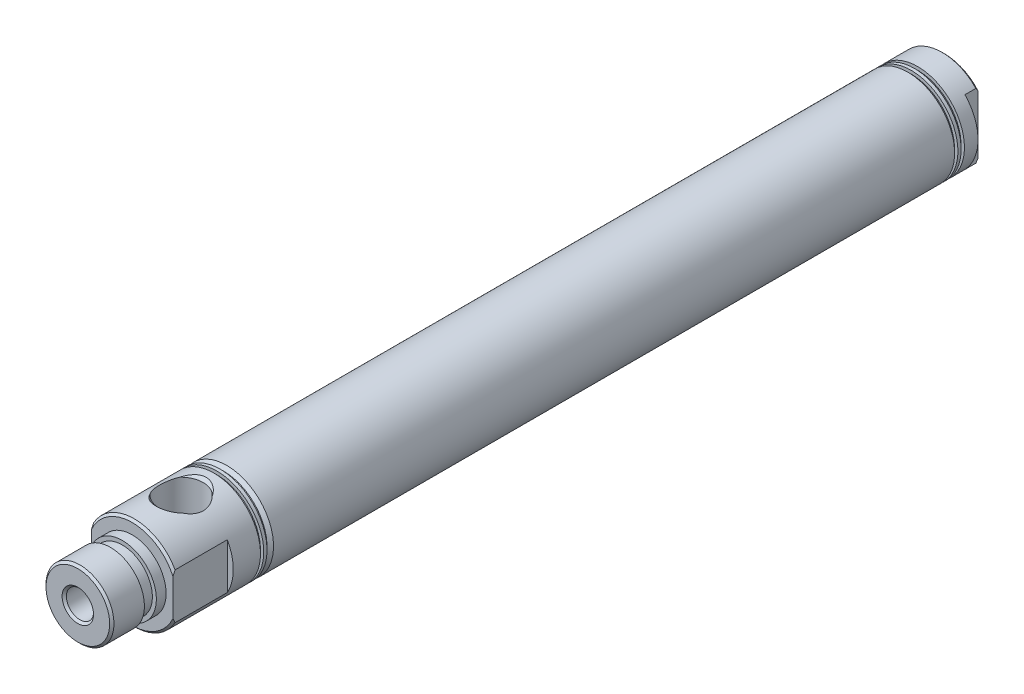
from build123d import *

# Parameters (mm, degrees)
EXTRUDE1_DEPTH      = 94.869
EXTRUDE1_DEPTH_BACK = 94.869
SKETCH1_R           = 10.922
SKETCH3_W           = 0.762
SKETCH3_H           = 0.762
RODHOLE_START       = -173.569
SKETCH8_R           = 3.175
RODHOLE_DEPTH       = 173.569
SKETCH9_R           = 9.525
STROKECHAMBER_DEPTH = 132
CHAMFER1_SIZE       = 0.5
FLATS_DEPTH         = 109.672305273
FLATS_DEPTH_BACK    = 109.672305273
SKETCH4_W           = 1.397
SKETCH4_H           = 12.7
SKETCH4_W_2         = 3.048
SKETCH4_H_2         = 3.048


with BuildPart() as part:
    # Sketch1 → Extrude1 (new, two sides: drawn at the far end of the back side and taken through both)
    with BuildSketch(Plane.XY.offset(-EXTRUDE1_DEPTH_BACK)):
        Circle(SKETCH1_R)
    extrude(amount=EXTRUDE1_DEPTH + EXTRUDE1_DEPTH_BACK)

    # Sketch2 → Nose (revolve)
    with BuildSketch(Plane(origin=(0, 0, 0), x_dir=(0, 0, -1), z_dir=(1, 0, 0)), mode=Mode.PRIVATE) as nose_sk:
        Polygon((-94.869, 7.9248), (-97.155, 7.9248), (-97.155, 7), (-99.955, 7), (-99.955, 7.9375), (-107.569, 7.9375), (-107.569, 0), (-94.869, 0), align=None)
    revolve(nose_sk.sketch.rotate(Axis((0, 0, 0), (0, 0, 1)), 90), axis=Axis((0, 0, 0), (0, 0, 1)))

    # Sketch3 → CoverGrooves (revolve, cut)
    with BuildSketch(Plane(origin=(0, 0, 0), x_dir=(0, 0, -1), z_dir=(1, 0, 0)), mode=Mode.PRIVATE) as covergrooves_sk:
        with Locations((-75.438, 10.541)):
            Rectangle(SKETCH3_W, SKETCH3_H)
        Polygon((-74.295, 10.922), (-74.295, 10.16), (-73.533, 10.16), (-72.771, 10.922), align=None)
        Polygon((88.646, 10.922), (88.646, 10.16), (87.884, 10.922), align=None)
        Polygon((87.122, 10.922), (87.122, 10.16), (86.36, 10.922), align=None)
    revolve(covergrooves_sk.sketch.rotate(Axis((0, 0, 0), (0, 0, 1)), 90), axis=Axis((0, 0, 0), (0, 0, 1)), mode=Mode.SUBTRACT)

    # Sketch7 → FrontPort (revolve, cut)
    with BuildSketch(Plane(origin=(0, 0, 0), x_dir=(0, 0, -1), z_dir=(1, 0, 0))):
        Polygon((-83.439, 10.922), (-77.589, 10.922), (-78.289, 10.222), (-78.289, 0), (-83.439, 0), align=None)
    revolve(axis=Axis((0, 0, 83.439), (0, 1, 0)), mode=Mode.SUBTRACT)

    # Sketch8 → RodHole (cut)
    with BuildSketch(Plane.XY.offset(107.569).offset(RODHOLE_START)):
        Circle(SKETCH8_R)
    extrude(amount=RODHOLE_DEPTH, mode=Mode.SUBTRACT)

    # Sketch9 → StrokeChamber (cut)
    with BuildSketch(Plane.XY.offset(-66)):
        with Locations(Location((0, 0, 0), (0, 0, 180))):
            Circle(SKETCH9_R)
    extrude(amount=STROKECHAMBER_DEPTH, mode=Mode.SUBTRACT)

    # Chamfer1
    chamfer1_edges = [part.edges().sort_by_distance(p)[0] for p in [
        (-10.922, 0, -94.869),
        (-3.175, 0, 107.569),
        (7.9375, 0, 107.569),
        (-10.922, 0, 94.869),
    ]]
    chamfer(chamfer1_edges, length=CHAMFER1_SIZE)

    # Sketch4 → Flats (cut, two sides: drawn at the far end of the back side and taken through both)
    with BuildSketch(Plane(origin=(0, 0, 0), x_dir=(1, 0, 0), z_dir=(0, 1, 0)).offset(-FLATS_DEPTH_BACK)):
        with Locations((10.2235, -88.519)):
            Rectangle(SKETCH4_W, SKETCH4_H)
        with Locations((9.398, 93.345)):
            Rectangle(SKETCH4_W_2, SKETCH4_H_2)
        with Locations((-9.398, 93.345)):
            Rectangle(SKETCH4_W_2, SKETCH4_H_2)
        with Locations((-10.2235, -88.519)):
            Rectangle(SKETCH4_W, SKETCH4_H)
    extrude(amount=FLATS_DEPTH + FLATS_DEPTH_BACK, mode=Mode.SUBTRACT)

    # Sketch10 → RearStdPort (revolve, cut)
    with BuildSketch(Plane(origin=(0, 0, 0), x_dir=(0, 0, -1), z_dir=(1, 0, 0)), mode=Mode.PRIVATE) as rearstdport_sk:
        Polygon((94.869, 0), (94.869, 5.85), (94.169, 5.15), (0, 5.15), (0, 0), align=None)
    revolve(rearstdport_sk.sketch.rotate(Axis((0, 0, 0), (0, 0, 1)), 90), axis=Axis((0, 0, 0), (0, 0, 1)), mode=Mode.SUBTRACT)


solid = part.part
